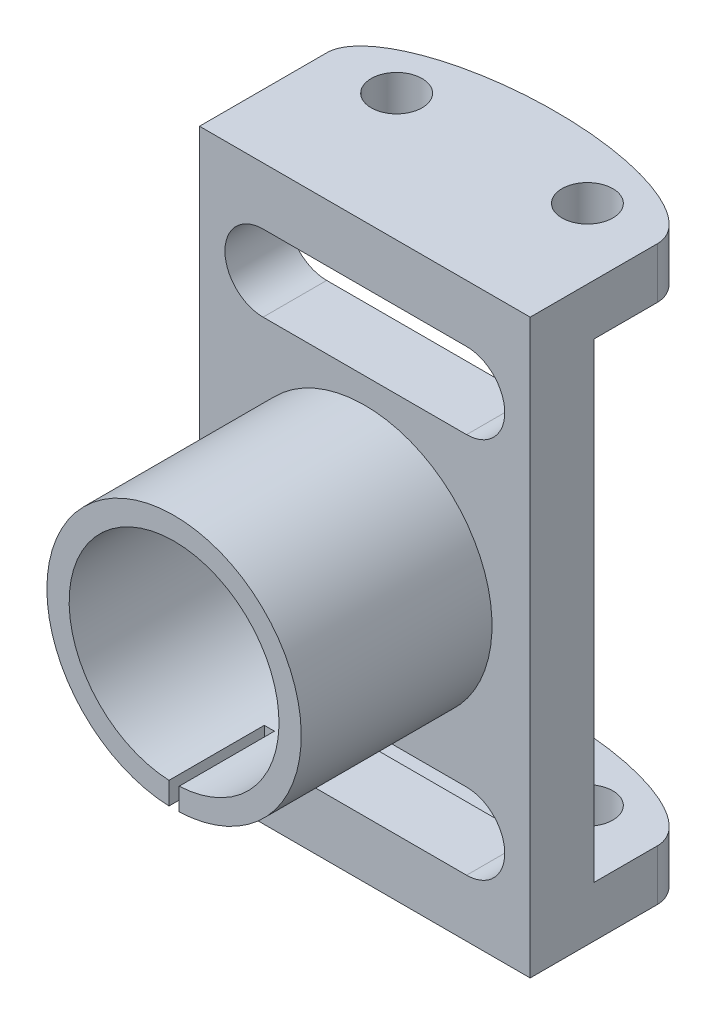
from build123d import *
from build123d.topology import SkipClean

# Parameters (mm, degrees)
SKETCH1_W           = 26
SKETCH1_H           = 45
SKETCH1_R           = 8.25
BOSS_EXTRUDE1_DEPTH = 5
SKETCH2_R           = 10
SKETCH2_R_2         = 8.25
BOSS_EXTRUDE2_DEPTH = 7.5
BOSS_EXTRUDE3_DEPTH = 7.5
SKETCH5_R           = 2
BOSS_EXTRUDE4_DEPTH = 4
BOSS_EXTRUDE5_START = -41
SKETCH5_2_R         = 2
BOSS_EXTRUDE5_DEPTH = 4


with BuildPart() as part:
    # Sketch1 → Boss-Extrude1 (new body)
    with BuildSketch(Plane.XY):
        with Locations((13, 22.5)):
            Rectangle(SKETCH1_W, SKETCH1_H)
        with Locations((13, 22.5)):
            Circle(SKETCH1_R, mode=Mode.SUBTRACT)
        with BuildLine():
            Line((21, 34.5), (5, 34.5))
            ThreePointArc((5, 34.5), (2, 37.5), (5, 40.5))
            Line((5, 40.5), (21, 40.5))
            ThreePointArc((21, 40.5), (24, 37.5), (21, 34.5))
        make_face(mode=Mode.SUBTRACT)
        with BuildLine():
            Line((21, 10.5), (5, 10.5))
            ThreePointArc((5, 10.5), (2, 7.5), (5, 4.5))
            Line((5, 4.5), (21, 4.5))
            ThreePointArc((21, 4.5), (24, 7.5), (21, 10.5))
        make_face(mode=Mode.SUBTRACT)
    extrude(amount=BOSS_EXTRUDE1_DEPTH)

    # Sketch2 → Boss-Extrude2 (add)
    with BuildSketch(Plane.XY.offset(5)):
        with Locations((13, 22.5)):
            Circle(SKETCH2_R)
        with Locations((13, 22.5)):
            Circle(SKETCH2_R_2, mode=Mode.SUBTRACT)
    extrude(amount=BOSS_EXTRUDE2_DEPTH)

    # Sketch3 → Boss-Extrude3 (add)
    with SkipClean():  # the faces are left unmerged after this step: merging them gives an invalid solid
        with BuildSketch(Plane.XY.offset(12.5)):
            with BuildLine():
                ThreePointArc((21.25, 22.5), (18.973378441, 16.80954747), (13.4, 14.259702675))
                Line((13.4, 14.259702675), (13.4, 12.508003203))
                ThreePointArc((13.4, 12.508003203), (20.211102551, 15.57179677), (23, 22.5))
                ThreePointArc((23, 22.5), (6.07179677, 29.711102551), (12.6, 12.508003203))
                Line((12.6, 12.508003203), (12.6, 14.259702675))
                ThreePointArc((12.6, 14.259702675), (7.30954747, 28.473378441), (21.25, 22.5))
            make_face()
        extrude(amount=BOSS_EXTRUDE3_DEPTH)

    # Sketch5 → Boss-Extrude4 (add)
    with SkipClean():  # the faces are left unmerged after this step: merging them gives an invalid solid
        with BuildSketch(Plane(origin=(0, 45, 0), x_dir=(1, 0, 0), z_dir=(0, 1, 0))):
            with BuildLine():
                Line((0, 5), (0, 0))
                Line((0, 0), (26, 0))
                Line((26, 0), (26, 5))
                add(Edge.make_bspline(
                    [(26, 5), (26, 10), (13, 10), (0, 10), (0, 5)],
                    knots=[0, 0, 0, 1.570796327, 1.570796327, 3.141592654, 3.141592654, 3.141592654], degree=2, weights=[1, 0.707106781, 1, 0.707106781, 1]))
            make_face()
            with Locations((5.5, 5)):
                Circle(SKETCH5_R, mode=Mode.SUBTRACT)
            with Locations((20.5, 5)):
                Circle(SKETCH5_R, mode=Mode.SUBTRACT)
        extrude(amount=-BOSS_EXTRUDE4_DEPTH)

    # Sketch5<2> → Boss-Extrude5 (add)
    with SkipClean():  # the faces are left unmerged after this step: merging them gives an invalid solid
        with BuildSketch(Plane(origin=(0, 45, 0), x_dir=(1, 0, 0), z_dir=(0, 1, 0)).offset(BOSS_EXTRUDE5_START)):
            with BuildLine():
                Line((0, 5), (0, 0))
                Line((0, 0), (26, 0))
                Line((26, 0), (26, 5))
                add(Edge.make_bspline(
                    [(26, 5), (26, 10), (13, 10), (0, 10), (0, 5)],
                    knots=[0, 0, 0, 1.570796327, 1.570796327, 3.141592654, 3.141592654, 3.141592654], degree=2, weights=[1, 0.707106781, 1, 0.707106781, 1]))
            make_face()
            with Locations((5.5, 5)):
                Circle(SKETCH5_2_R, mode=Mode.SUBTRACT)
            with Locations((20.5, 5)):
                Circle(SKETCH5_2_R, mode=Mode.SUBTRACT)
        extrude(amount=-BOSS_EXTRUDE5_DEPTH)


solid = part.part
